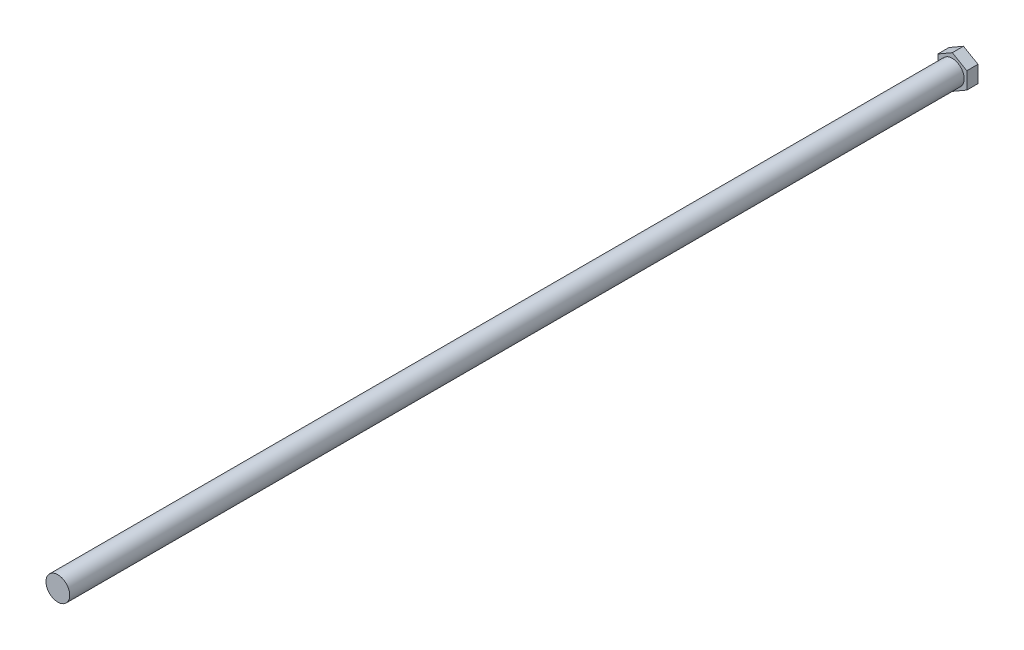
from build123d import *

# Parameters (mm, degrees)
SKETCH2_R           = 2.125
BOSS_EXTRUDE1_DEPTH = 160
BOSS_EXTRUDE2_DEPTH = 2


with BuildPart() as part:
    # Sketch2 → Boss-Extrude1 (new body)
    with BuildSketch(Plane.XY):
        Circle(SKETCH2_R)
    extrude(amount=BOSS_EXTRUDE1_DEPTH)

    # Sketch3 → Boss-Extrude2 (add)
    with BuildSketch(Plane(origin=(0, 0, 0), x_dir=(-1, 0, 0), z_dir=(0, 0, -1))):
        Polygon((0, 3), (-2.598076211, 1.5), (-2.598076211, -1.5), (0, -3), (2.598076211, -1.5), (2.598076211, 1.5), align=None)
    extrude(amount=BOSS_EXTRUDE2_DEPTH)


solid = part.part
